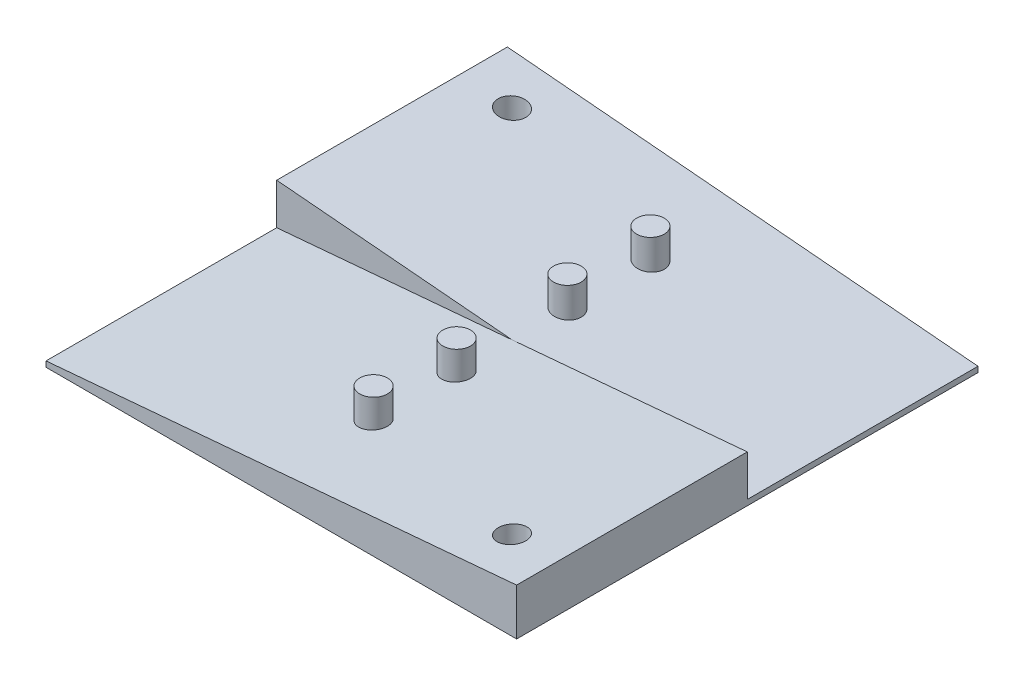
from build123d import *

# Parameters (mm, degrees)
ESBO_O2_W                = 51
ESBO_O2_H                = 50
RESSALTO_EXTRUS_O2_DEPTH = 6
CORTE_EXTRUS_O1_DEPTH    = 25
CORTE_EXTRUS_O3_DEPTH    = 25
ESBO_O5_R                = 1.5
RESSALTO_EXTRUS_O3_DEPTH = 6
ESBO_O8_R                = 1.5
CORTE_EXTRUS_O6_DEPTH    = 37.211186117
CHANFRO2_SIZE            = 1.5


with BuildPart() as part:
    # Esboço2 → Ressalto-extrusão2 (new body)
    with BuildSketch(Plane(origin=(0, 0, 0), x_dir=(1, 0, 0), z_dir=(0, 1, 0))):
        Rectangle(ESBO_O2_W, ESBO_O2_H)
    extrude(amount=RESSALTO_EXTRUS_O2_DEPTH)

    # Esboço3 → Corte-extrusão1 (cut)
    with BuildSketch(Plane.XY.offset(25)):
        Polygon((-25.5, 0.6), (25.5, 5.06192184), (25.5, 6), (-25.5, 6), align=None)
    extrude(amount=-CORTE_EXTRUS_O1_DEPTH, mode=Mode.SUBTRACT)

    # Esboço4 → Corte-extrusão3 (cut)
    with BuildSketch(Plane(origin=(0, 0, -25), x_dir=(-1, 0, 0), z_dir=(0, 0, -1))):
        Polygon((-25.5, 0.6), (25.5, 5.06192184), (25.5, 6), (-25.5, 6), align=None)
    extrude(amount=-CORTE_EXTRUS_O3_DEPTH, mode=Mode.SUBTRACT)

    # Esboço5 → Ressalto-extrusão3 (add)
    with BuildSketch(Plane.XZ):
        with Locations(Location((0, 6, 0), (0, 0, 270))):
            Circle(ESBO_O5_R)
        with Locations(Location((0, 15, 0), (0, 0, 270))):
            Circle(ESBO_O5_R)
        with Locations(Location((0, -15, 0), (0, 0, 270))):
            Circle(ESBO_O5_R)
        with Locations(Location((0, -6, 0), (0, 0, 270))):
            Circle(ESBO_O5_R)
    extrude(amount=-RESSALTO_EXTRUS_O3_DEPTH)

    # Esboço8 → Corte-extrusão6 (cut, through all)
    with BuildSketch(Plane.XZ):
        with Locations(Location((20, 20, 0), (0, 0, 270))):
            Circle(ESBO_O8_R)
        with Locations(Location((-20, -20, 0), (0, 0, 270))):
            Circle(ESBO_O8_R)
    extrude(amount=-CORTE_EXTRUS_O6_DEPTH, mode=Mode.SUBTRACT)

    # Chanfro2
    chanfro2_edges = [part.edges().sort_by_distance(p)[0] for p in [
        (20, 0, 21.5),
        (-20, 0, -18.5),
    ]]
    chamfer(chanfro2_edges, length=CHANFRO2_SIZE)


solid = part.part
